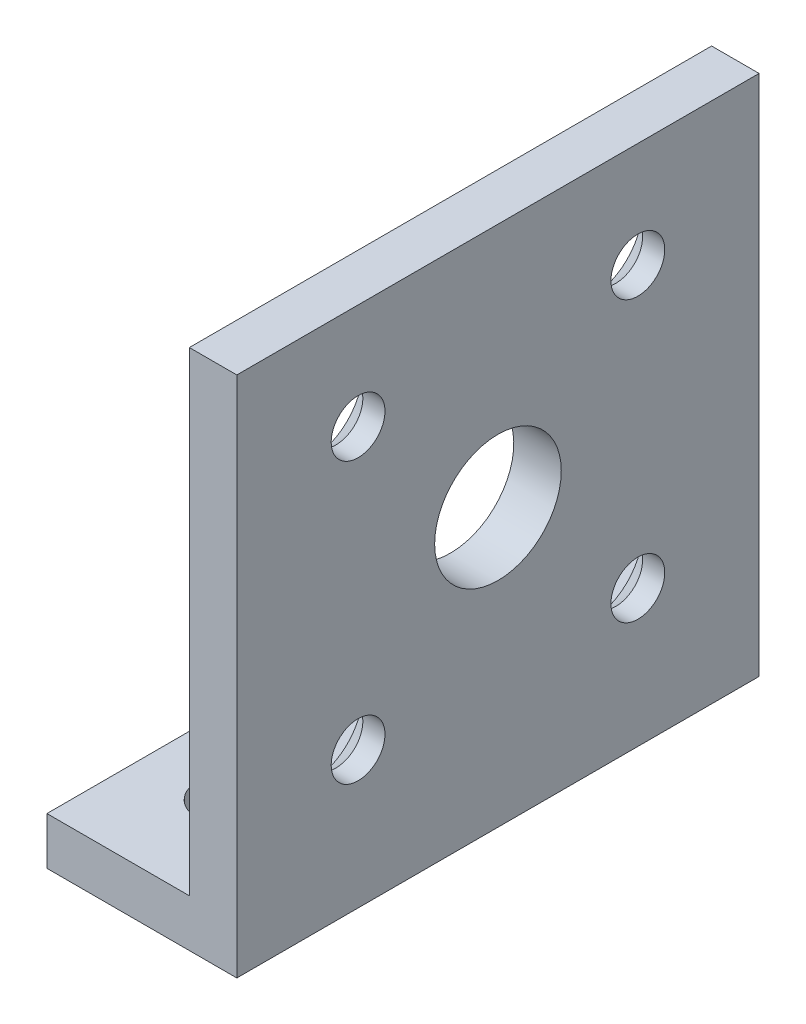
from build123d import *

# Parameters (mm, degrees)
EXTRUDE_1_DEPTH           = 16.5
CUT_EXTRUDE_1_REACH       = 39.977
SKETCH_4_R                = 4
HOLE_WIZARD_2_D           = 3.4
HOLE_WIZARD_2_DEPTH       = 10
HOLE_WIZARD_2_CSINK_D     = 6.6
HOLE_WIZARD_2_CSINK_ANGLE = 90
HOLE_WIZARD_2_TIP         = 1.021463052
HOLE_WIZARD_M4_1_D        = 4


with BuildPart() as part:
    # 草图1 → 拉伸-薄壁1 (new, symmetric)
    with BuildSketch(Plane.XY):
        Polygon((0, 33), (0, 0), (-12, 0), (-12, 3), (-3, 3), (-3, 33), align=None)
    extrude(amount=EXTRUDE_1_DEPTH, both=True)

    # 草图4 → 切除-拉伸1 (cut, up to next)
    with BuildSketch(Plane.ZY.offset(3), mode=Mode.PRIVATE) as cut_extrude_1_sk1:
        with Locations(Location((0, 17.5, 0), (0, 0, 270))):
            Circle(SKETCH_4_R)
    cut_extrude_1_tool1 = extrude(cut_extrude_1_sk1.sketch, amount=-CUT_EXTRUDE_1_REACH, mode=Mode.PRIVATE) & part.part
    add(cut_extrude_1_tool1.solids().sort_by_distance((-3, 17.5, 0))[0], mode=Mode.SUBTRACT)

    # 打孔尺寸(%根据十字)槽半沉头木螺钉的类型2
    with Locations(Plane.ZY.offset(3)):
        with Locations((8.838834765, 8.661165235), (-8.838834765, 8.661165235), (-8.838834765, 26.338834765), (8.838834765, 26.338834765)):
            CounterSinkHole(HOLE_WIZARD_2_D / 2, HOLE_WIZARD_2_CSINK_D / 2, depth=HOLE_WIZARD_2_DEPTH, counter_sink_angle=HOLE_WIZARD_2_CSINK_ANGLE)
            with Locations((0, 0, -(HOLE_WIZARD_2_DEPTH + HOLE_WIZARD_2_TIP / 2))):  # 118° drill point
                Cone(0, HOLE_WIZARD_2_D / 2, HOLE_WIZARD_2_TIP, mode=Mode.SUBTRACT)

    # M4 螺纹孔1 (through all)
    with Locations(Plane(origin=(0, 3, 0), x_dir=(1, 0, 0), z_dir=(0, 1, 0))):
        with Locations((-7, 10), (-7, -10)):
            Hole(HOLE_WIZARD_M4_1_D / 2)


solid = part.part
